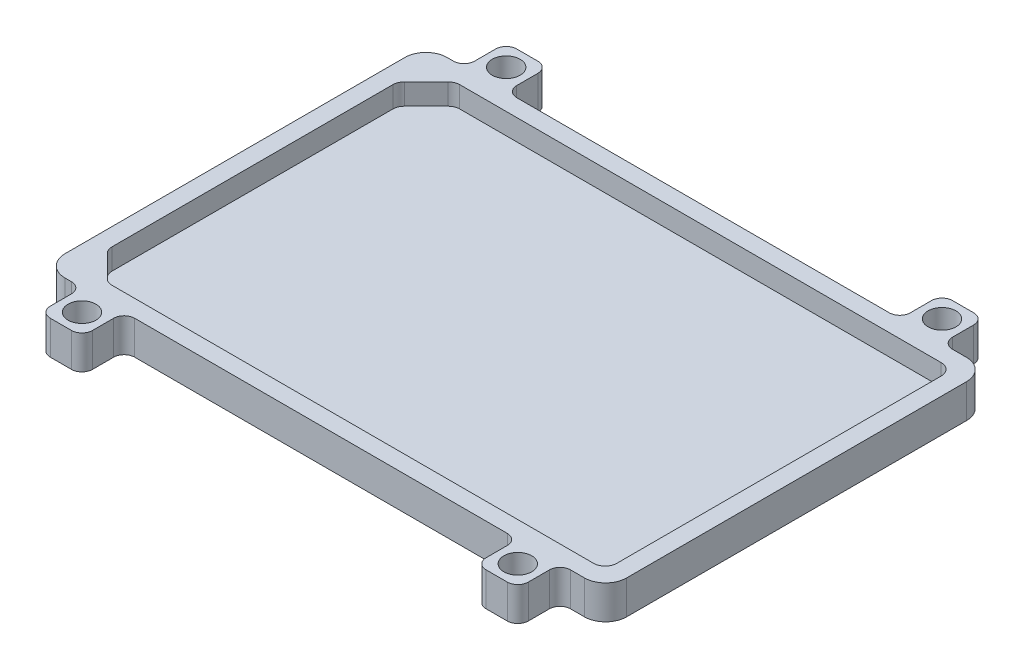
from build123d import *

# Parameters (mm, degrees)
SKETCH1_W            = 157.864
SKETCH1_H            = 90.551
BOSS_EXTRUDE1_DEPTH  = 8
CUT_EXTRUDE21_DEPTH  = 5
FILLET8_R            = 2.75
SKETCH29_W           = 12.37533
SKETCH29_H           = 90.551
CUT_EXTRUDE25_DEPTH  = 183.166204596
FILLET9_R            = 5
SKETCH36_W           = 10
SKETCH36_H           = 10
SKETCH36_R           = 3.3
BOSS_EXTRUDE10_DEPTH = 8
FILLET10_R           = 2.5


with BuildPart() as part:
    # Sketch1 → Boss-Extrude1 (new body)
    with BuildSketch(Plane(origin=(0, 0, 0), x_dir=(1, 0, 0), z_dir=(0, 1, 0))):
        with Locations((78.932, -45.2755)):
            Rectangle(SKETCH1_W, SKETCH1_H)
    extrude(amount=BOSS_EXTRUDE1_DEPTH)

    # Sketch23 → Cut-Extrude21 (cut)
    with BuildSketch(Plane(origin=(0, 8, 0), x_dir=(1, 0, 0), z_dir=(0, 1, 0))):
        Polygon((141.332, -86.4755), (23.3181173, -86.4755), (16.532, -79.6893827), (16.532, -10.8616173), (23.3181173, -4.0755), (141.332, -4.0755), align=None)
    extrude(amount=-CUT_EXTRUDE21_DEPTH, mode=Mode.SUBTRACT)

    # Fillet8
    fillet8_edges = [part.edges().sort_by_distance(p)[0] for p in [
        (141.332, 5.5, 4.0755),
        (141.332, 5.5, 86.4755),
        (23.3181173, 5.5, 86.4755),
        (16.532, 5.5, 79.6893827),
        (16.532, 5.5, 10.8616173),
        (23.3181173, 5.5, 4.0755),
    ]]
    fillet(fillet8_edges, radius=FILLET8_R)

    # Sketch29 → Cut-Extrude25 (cut, through all)
    with BuildSketch(Plane(origin=(0, 8, 0), x_dir=(1, 0, 0), z_dir=(0, 1, 0))):
        with Locations((151.676335, -45.2755)):
            Rectangle(SKETCH29_W, SKETCH29_H)
        with Locations((6.187665, -45.2755)):
            Rectangle(SKETCH29_W, SKETCH29_H)
    extrude(amount=-CUT_EXTRUDE25_DEPTH, mode=Mode.SUBTRACT)

    # Fillet9
    fillet9_edges = [part.edges().sort_by_distance(p)[0] for p in [
        (145.48867, 4, 90.551),
        (145.48867, 4, 0),
        (12.37533, 4, 0),
        (12.37533, 4, 90.551),
    ]]
    fillet(fillet9_edges, radius=FILLET9_R)

    # Sketch36 → Boss-Extrude10 (add)
    # profile 1 of 4: a face of its own
    with BuildSketch(Plane.XZ):
        with Locations((26.3936, 95.551)):
            Rectangle(SKETCH36_W, SKETCH36_H)
        with Locations(Location((26.3936, 95.551, 0), (0, 0, 270))):
            Circle(SKETCH36_R, mode=Mode.SUBTRACT)
    # profile 2 of 4: a face of its own
    with BuildSketch(Plane.XZ):
        with Locations((129.6936, 95.551)):
            Rectangle(SKETCH36_W, SKETCH36_H)
        with Locations(Location((129.6936, 95.551, 0), (0, 0, 270))):
            Circle(SKETCH36_R, mode=Mode.SUBTRACT)
    # profile 3 of 4: a face of its own
    with BuildSketch(Plane.XZ):
        with Locations((26.3936, -5)):
            Rectangle(SKETCH36_W, SKETCH36_H)
        with Locations(Location((26.3936, -5, 0), (0, 0, 270))):
            Circle(SKETCH36_R, mode=Mode.SUBTRACT)
    # profile 4 of 4: a face of its own
    with BuildSketch(Plane.XZ):
        with Locations((129.6936, -5)):
            Rectangle(SKETCH36_W, SKETCH36_H)
        with Locations(Location((129.6936, -5, 0), (0, 0, 270))):
            Circle(SKETCH36_R, mode=Mode.SUBTRACT)
    extrude(amount=-BOSS_EXTRUDE10_DEPTH)

    # Fillet10
    fillet10_edges = [part.edges().sort_by_distance(p)[0] for p in [
        (21.3936, 4, 90.551),
        (21.3936, 4, 100.551),
        (31.3936, 4, 100.551),
        (31.3936, 4, 90.551),
        (124.6936, 4, 90.551),
        (124.6936, 4, 100.551),
        (134.6936, 4, 100.551),
        (134.6936, 4, 90.551),
        (31.3936, 4, 0),
        (31.3936, 4, -10),
        (21.3936, 4, -10),
        (21.3936, 4, 0),
        (124.6936, 4, -10),
        (124.6936, 4, 0),
        (134.6936, 4, 0),
        (134.6936, 4, -10),
    ]]
    fillet(fillet10_edges, radius=FILLET10_R)


solid = part.part
